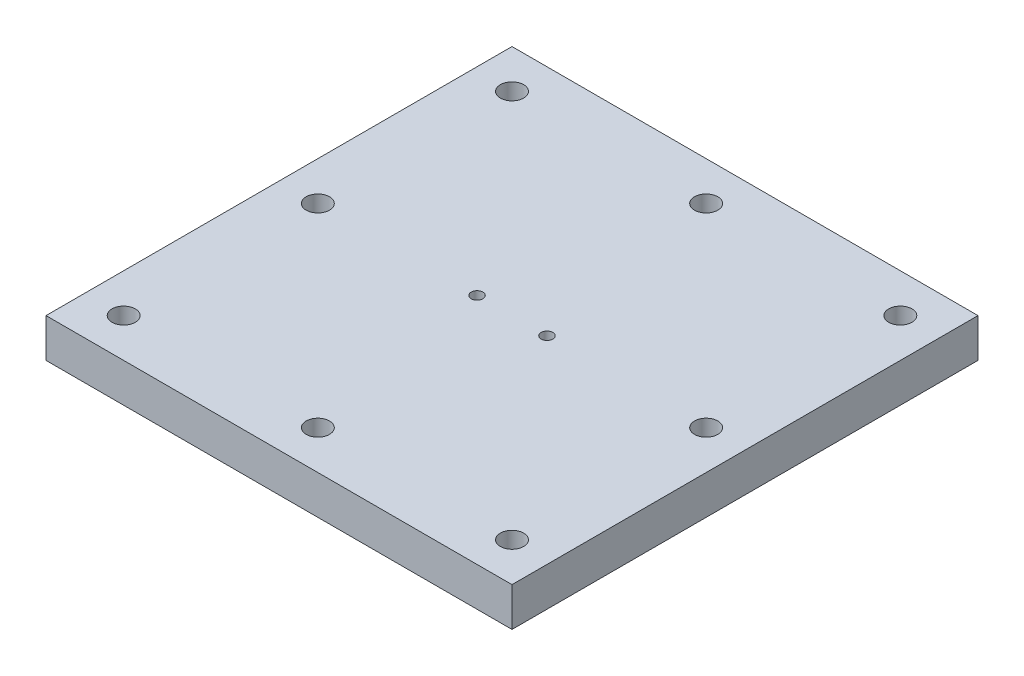
from build123d import *

# Parameters (mm, degrees)
SKETCH1_W           = 60
SKETCH1_H           = 60
SKETCH1_R           = 1.5
SKETCH1_R_2         = 0.75
BOSS_EXTRUDE1_DEPTH = 5


with BuildPart() as part:
    # Sketch1 → Boss-Extrude1 (new body)
    with BuildSketch(Plane(origin=(0, 0, 0), x_dir=(1, 0, 0), z_dir=(0, 1, 0))):
        Rectangle(SKETCH1_W, SKETCH1_H)
        with Locations(Location((25, 25, 0), (0, 0, 270))):
            Circle(SKETCH1_R, mode=Mode.SUBTRACT)
        with Locations(Location((25, -25, 0), (0, 0, 270))):
            Circle(SKETCH1_R, mode=Mode.SUBTRACT)
        with Locations(Location((-25, -25, 0), (0, 0, 270))):
            Circle(SKETCH1_R, mode=Mode.SUBTRACT)
        with Locations(Location((-25, 25, 0), (0, 0, 270))):
            Circle(SKETCH1_R, mode=Mode.SUBTRACT)
        with Locations(Location((0, 25, 0), (0, 0, 270))):
            Circle(SKETCH1_R, mode=Mode.SUBTRACT)
        with Locations(Location((25, 0, 0), (0, 0, 270))):
            Circle(SKETCH1_R, mode=Mode.SUBTRACT)
        with Locations(Location((-25, 0, 0), (0, 0, 270))):
            Circle(SKETCH1_R, mode=Mode.SUBTRACT)
        with Locations(Location((0, -25, 0), (0, 0, 270))):
            Circle(SKETCH1_R, mode=Mode.SUBTRACT)
        with Locations(Location((-4.5, 0, 0), (0, 0, 270))):
            Circle(SKETCH1_R_2, mode=Mode.SUBTRACT)
        with Locations(Location((4.5, 0, 0), (0, 0, 270))):
            Circle(SKETCH1_R_2, mode=Mode.SUBTRACT)
    extrude(amount=BOSS_EXTRUDE1_DEPTH)


solid = part.part
